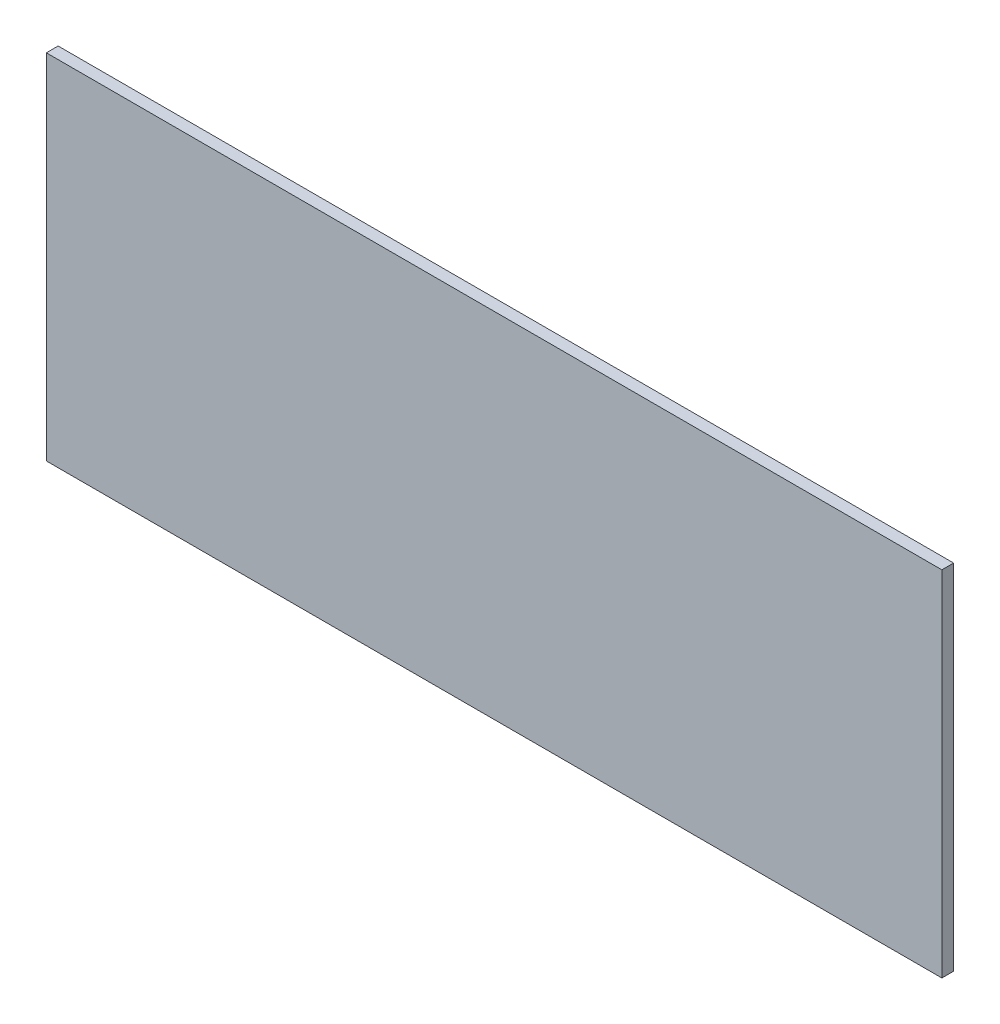
from build123d import *

# Parameters (mm, degrees)
ESQUISSE1_W        = 380
ESQUISSE1_H        = 150
BOSS_EXTRU_1_DEPTH = 5


with BuildPart() as part:
    # Esquisse1 → Boss.-Extru.1 (new body)
    with BuildSketch(Plane.XY):
        with Locations((-1.531306326, -52.107329843)):
            Rectangle(ESQUISSE1_W, ESQUISSE1_H)
    extrude(amount=BOSS_EXTRU_1_DEPTH)


solid = part.part
